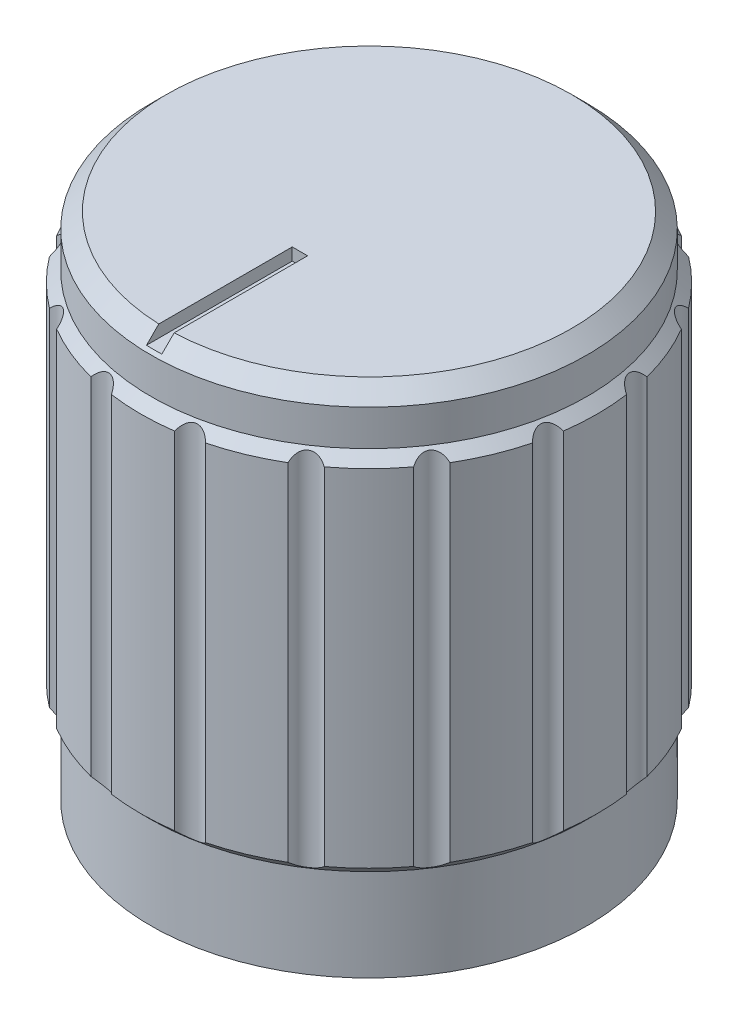
from build123d import *

# Parameters (mm, degrees)
SKETCH50_R           = 6
BOSS_EXTRUDE31_DEPTH = 12
SKETCH51_R           = 5
SKETCH51_R_2         = 4
CUT_EXTRUDE11_DEPTH  = 10
SKETCH53_W           = 0.5
SKETCH53_H           = 5
CUT_EXTRUDE12_DEPTH  = 0.4
CUT_EXTRUDE13_REACH  = 21.646
SKETCH54_R           = 0.5
CIRPATTERN1_COUNT    = 16


with BuildPart() as part:
    # Sketch50 → Boss-Extrude31 (new body)
    with BuildSketch(Plane(origin=(0, 17, 0), x_dir=(1, 0, 0), z_dir=(0, 1, 0))):
        with Locations(Location((0, 0, 0), (0, 0, 270))):
            Circle(SKETCH50_R)
        with BuildLine():
            Line((-2.598076211, 1.5), (2.598076211, 1.5))
            ThreePointArc((2.598076211, 1.5), (0, -3), (-2.598076211, 1.5))
        make_face(mode=Mode.SUBTRACT)
    extrude(amount=BOSS_EXTRUDE31_DEPTH)

    # Sketch51 → Cut-Extrude11 (cut)
    with BuildSketch(Plane.XZ.offset(-17)):
        with Locations(Location((0, 0, 0), (0, 0, 270))):
            Circle(SKETCH51_R)
        with Locations(Location((0, 0, 0), (0, 0, 270))):
            Circle(SKETCH51_R_2, mode=Mode.SUBTRACT)
    extrude(amount=-CUT_EXTRUDE11_DEPTH, mode=Mode.SUBTRACT)


with BuildPart() as body_2:
    # Sketch52 → Revolve2 (revolve)
    with BuildSketch(Plane.XY, mode=Mode.PRIVATE) as revolve2_sk:
        Polygon((0, 29), (0, 31), (6.6, 31), (7.1, 30.5), (7.1, 29.33), (7.43, 29), (7.43, 17.73), (7.1, 17.4), (7.1, 14.4), (6, 14.4), (6, 29), align=None)
    revolve(revolve2_sk.sketch.rotate(Axis((0, 29, 0), (0, 1, 0)), 90), axis=Axis((0, 29, 0), (0, 1, 0)))

    # Sketch53 → Cut-Extrude12 (cut)
    with BuildSketch(Plane(origin=(0, 31, 0), x_dir=(1, 0, 0), z_dir=(0, 1, 0))):
        with Locations((0, -4.75)):
            Rectangle(SKETCH53_W, SKETCH53_H)
    extrude(amount=-CUT_EXTRUDE12_DEPTH, mode=Mode.SUBTRACT)

    # Cut-Extrude13: up to this cone (the profile starts inside it)
    cut_extrude13_end = Plane(origin=(0, 31, 0), z_dir=(0, 1, 0)).offset(-20.699999) * Cone(1e-06, 63.546, 63.545999, align=(Align.CENTER, Align.CENTER, Align.MIN), mode=Mode.PRIVATE)
    # Sketch54 → Cut-Extrude13 (cut, up to the surface)
    with BuildSketch(Plane(origin=(0, 31, 0), x_dir=(1, 0, 0), z_dir=(0, 1, 0)), mode=Mode.PRIVATE) as cut_extrude13_sk1:
        with Locations((1.498293673, 7.532430953)):
            Circle(SKETCH54_R)
    cut_extrude13_tool1 = extrude(cut_extrude13_sk1.sketch, amount=-CUT_EXTRUDE13_REACH, mode=Mode.PRIVATE) & cut_extrude13_end
    cut_extrude13 = cut_extrude13_tool1.solids().sort_by_distance((1.498294, 31, -7.532431))[0]
    add(cut_extrude13, mode=Mode.SUBTRACT)

    # CirPattern1: Cut-Extrude13 ×16 about axis
    cirpattern1_axis = Axis((0, 0, 0), (0, 1, 0))
    for i in range(1, CIRPATTERN1_COUNT):
        add(cut_extrude13.rotate(cirpattern1_axis, i * 360 / CIRPATTERN1_COUNT), mode=Mode.SUBTRACT)


solid = Compound([part.part, body_2.part])
